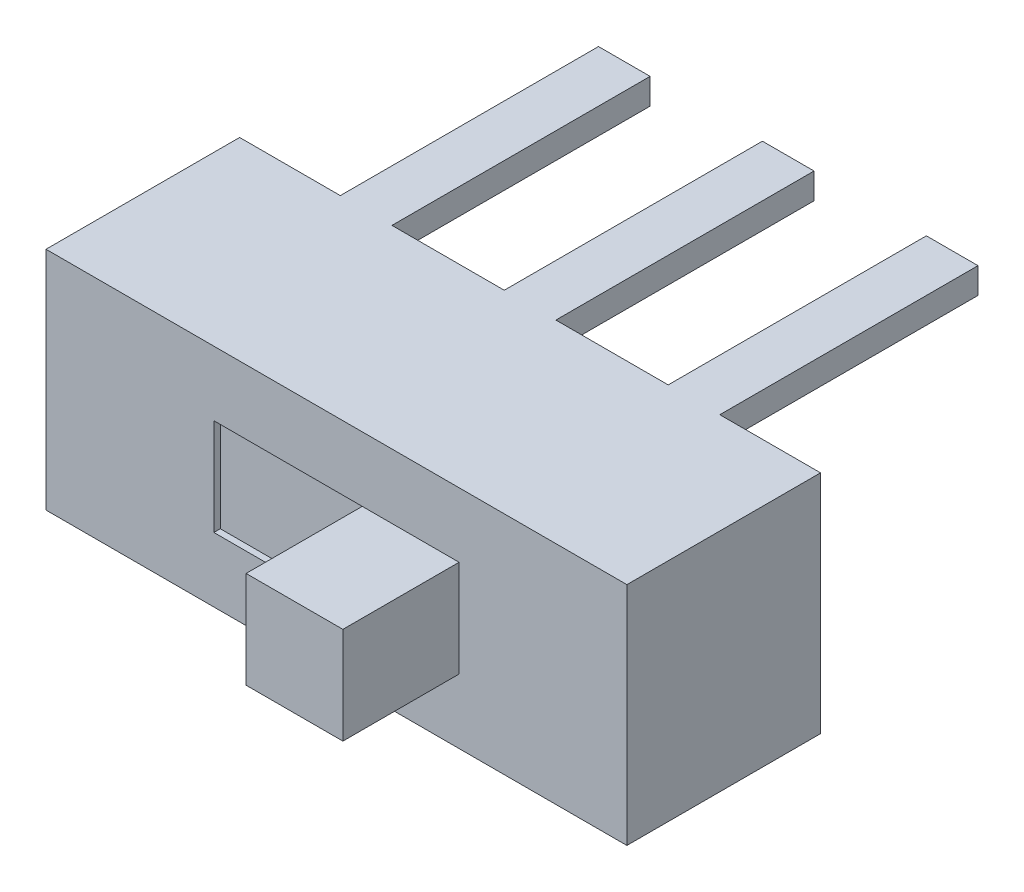
from build123d import *

# Parameters (mm, degrees)
SKETCH_1_W          = 9
SKETCH_1_H          = 3
EXTRUDE_1_DEPTH     = 3.5
SKETCH_2_W          = 3.8
SKETCH_2_H          = 1.5
CUT_EXTRUDE_1_DEPTH = 0.1
SKETCH_3_W          = 1.5
SKETCH_3_H          = 1.5
EXTRUDE_2_DEPTH     = 1.9
SKETCH_4_W          = 0.8
SKETCH_4_H          = 0.4
EXTRUDE_3_DEPTH     = 4


with BuildPart() as part:
    # Эскиз1 → Бобышка-Вытянуть1 (new body)
    with BuildSketch(Plane(origin=(0, 0, 0), x_dir=(1, 0, 0), z_dir=(0, 1, 0))):
        Rectangle(SKETCH_1_W, SKETCH_1_H)
    extrude(amount=EXTRUDE_1_DEPTH)

    # Эскиз2 → Вырез-Вытянуть1 (cut)
    with BuildSketch(Plane.XY.offset(1.5)):
        with Locations((0, 1.75)):
            Rectangle(SKETCH_2_W, SKETCH_2_H)
    extrude(amount=-CUT_EXTRUDE_1_DEPTH, mode=Mode.SUBTRACT)

    # Эскиз3 → Бобышка-Вытянуть2 (add)
    with BuildSketch(Plane.XY.offset(1.4)):
        with Locations((1.15, 1.75)):
            Rectangle(SKETCH_3_W, SKETCH_3_H)
    extrude(amount=EXTRUDE_2_DEPTH)

    # Эскиз4 → Бобышка-Вытянуть3 (add)
    with BuildSketch(Plane(origin=(0, 0, -1.5), x_dir=(-1, 0, 0), z_dir=(0, 0, -1))):
        with Locations((-2.54, 3.3)):
            Rectangle(SKETCH_4_W, SKETCH_4_H)
        with Locations((0, 3.3)):
            Rectangle(SKETCH_4_W, SKETCH_4_H)
        with Locations((2.54, 3.3)):
            Rectangle(SKETCH_4_W, SKETCH_4_H)
    extrude(amount=EXTRUDE_3_DEPTH)


solid = part.part
